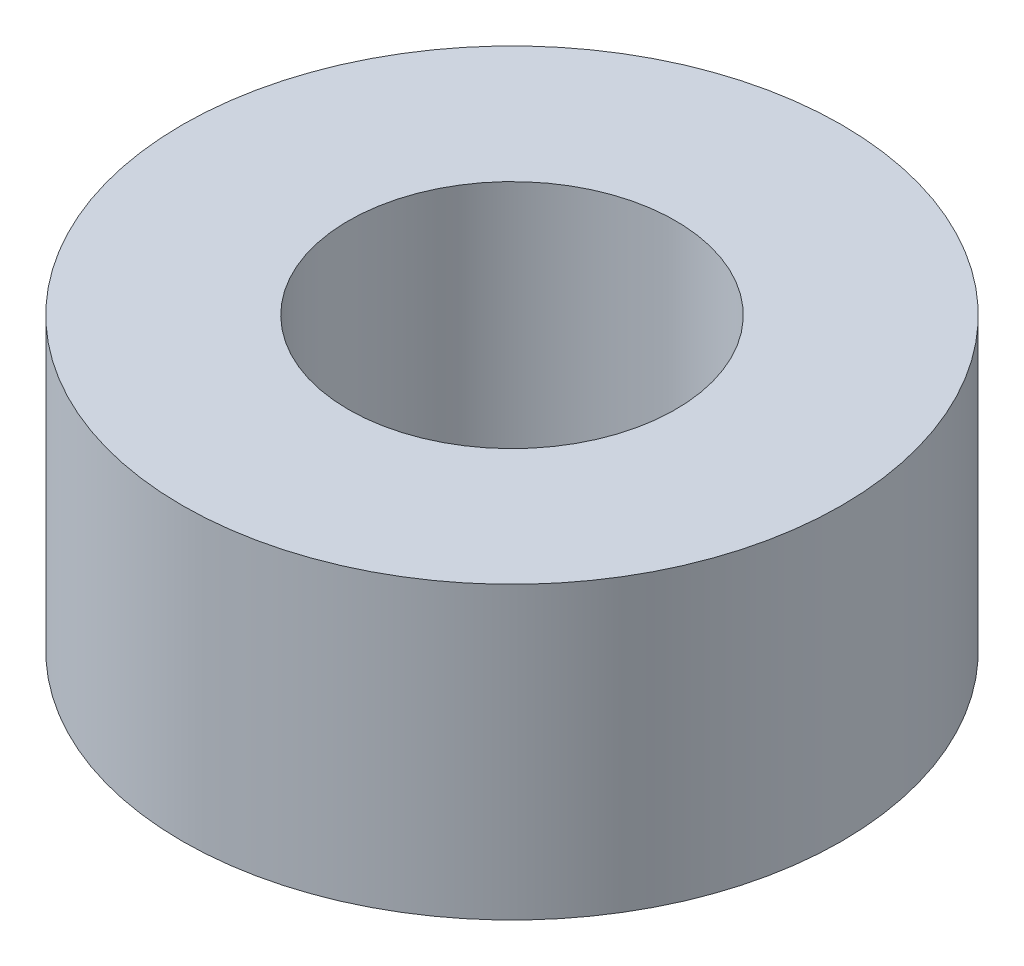
from build123d import *

# Parameters (mm, degrees)
SKETCH1_R           = 10.08
SKETCH1_R_2         = 5
BOSS_EXTRUDE1_DEPTH = 8.89


with BuildPart() as part:
    # Sketch1 → Boss-Extrude1 (new body)
    with BuildSketch(Plane(origin=(0, 0, 0), x_dir=(1, 0, 0), z_dir=(0, 1, 0))):
        with Locations(Location((0, 0, 0), (0, 0, 270))):
            Circle(SKETCH1_R)
        with Locations(Location((0, 0, 0), (0, 0, 270))):
            Circle(SKETCH1_R_2, mode=Mode.SUBTRACT)
    extrude(amount=BOSS_EXTRUDE1_DEPTH)


solid = part.part
